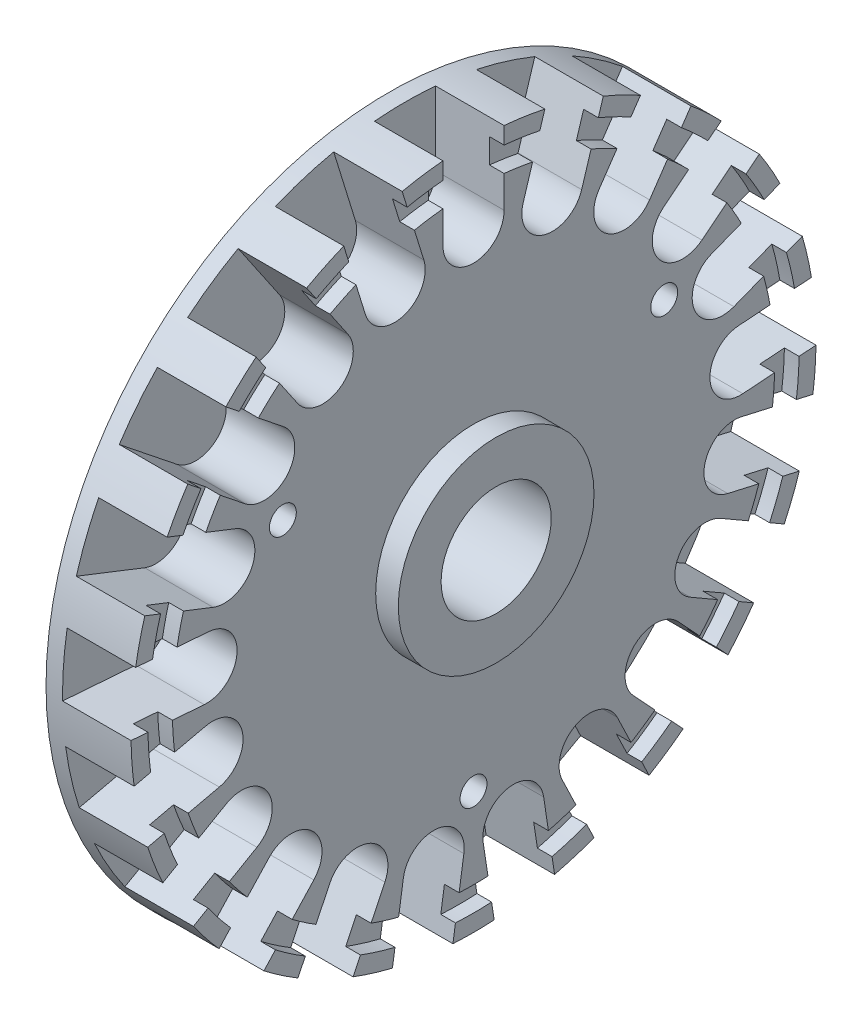
from build123d import *

# Parameters (mm, degrees)
CUT_EXTRUDE1_DEPTH      = 6.5
CIRPATTERN1_COUNT       = 21
BOSS_EXTRUDE1_START     = 1.85
SKETCH6_R               = 8
SKETCH6_R_2             = 4.5
BOSS_EXTRUDE1_DEPTH     = 1.85
M2_CLEARANCE_HOLE1_D    = 2.2
SKETCH10_R              = 28
CUT_EXTRUDE2_DEPTH      = 1.8
SKETCH11_R              = 28
BOSS_EXTRUDE2_DEPTH     = 0.9
SKETCH16_R              = 28
CUT_EXTRUDE4_DEPTH      = 1.25
CUT_EXTRUDE5_DEPTH      = 41.292710259
CUT_EXTRUDE5_DEPTH_BACK = 41.292710259
SKETCH21_R              = 4.5
SKETCH21_R_2            = 1.1


with BuildPart() as part:
    # Sketch2 → Revolve1 (revolve)
    with BuildSketch(Plane.XY, mode=Mode.PRIVATE) as revolve1_sk:
        Polygon((0, 4.5), (10, 4.5), (10, 24.62), (8.8, 24.62), (8.8, 26.62), (10, 26.62), (10, 28), (0, 28), align=None)
    revolve(revolve1_sk.sketch.rotate(Axis((-52.748606031, 0, 0), (1, 0, 0)), 90), axis=Axis((-52.748606031, 0, 0), (1, 0, 0)))

    # Sketch4 → Cut-Extrude1 (cut)
    with BuildSketch(Plane(origin=(10, 0, 0), x_dir=(0, 0, -1), z_dir=(1, 0, 0))):
        with BuildLine():
            Line((-2.499749016, 27.888192033), (-2.5, 21.888192038))
            ThreePointArc((-2.5, 21.888192038), (0, 19.388087459), (2.5, 21.888192038))
            Line((2.5, 21.888192038), (2.499749016, 27.888192033))
            ThreePointArc((2.499749016, 27.888192033), (0, 30.387836485), (-2.499749016, 27.888192033))
        make_face()
    cut_extrude1 = extrude(amount=-CUT_EXTRUDE1_DEPTH, mode=Mode.SUBTRACT)

    # CirPattern1: Cut-Extrude1 ×21 about axis
    cirpattern1_axis = Axis((0, 0, 0), (1, 0, 0))
    for i in range(1, CIRPATTERN1_COUNT):
        add(cut_extrude1.rotate(cirpattern1_axis, i * 360 / CIRPATTERN1_COUNT), mode=Mode.SUBTRACT)

    # Sketch6 → Boss-Extrude1 (add)
    with BuildSketch(Plane(origin=(10, 0, 0), x_dir=(0, 0, -1), z_dir=(1, 0, 0)).offset(BOSS_EXTRUDE1_START)):
        with Locations(Location((0, 0, 0), (0, 0, 180))):
            Circle(SKETCH6_R)
        with Locations(Location((0, 0, 0), (0, 0, 180))):
            Circle(SKETCH6_R_2, mode=Mode.SUBTRACT)
    extrude(amount=-BOSS_EXTRUDE1_DEPTH)

    # M2 Clearance Hole1 (through all)
    with Locations(Plane.ZY):
        with Locations((0, 0), (-1e-09, -18), (-15.588457268, 9.000000001), (15.588457268, 8.999999999)):
            Hole(M2_CLEARANCE_HOLE1_D / 2)

    # Sketch10 → Cut-Extrude2 (cut)
    with BuildSketch(Plane.ZY):
        Circle(SKETCH10_R)
    extrude(amount=-CUT_EXTRUDE2_DEPTH, mode=Mode.SUBTRACT)

    # Sketch11 → Boss-Extrude2 (add)
    with BuildSketch(Plane(origin=(3.5, 0, 0), x_dir=(0, 0, -1), z_dir=(1, 0, 0))):
        with Locations(Location((0, 0, 0), (0, 0, 180))):
            Circle(SKETCH11_R)
    extrude(amount=BOSS_EXTRUDE2_DEPTH)

    # Sketch16 → Cut-Extrude4 (cut)
    with BuildSketch(Plane.ZY.offset(-1.8)):
        Circle(SKETCH16_R)
    extrude(amount=-CUT_EXTRUDE4_DEPTH, mode=Mode.SUBTRACT)

    # Sketch21 → Cut-Extrude5 (cut, two sides: drawn at the far end of the back side and taken through both)
    with BuildSketch(Plane(origin=(4.4, 0, 0), x_dir=(0, 0, -1), z_dir=(1, 0, 0)).offset(-CUT_EXTRUDE5_DEPTH_BACK)):
        with Locations(Location((0, 0, 0), (0, 0, 180))):
            Circle(SKETCH21_R)
        with Locations(Location((1e-09, -18, 0), (0, 0, 180))):
            Circle(SKETCH21_R_2)
        with Locations(Location((-15.588457268, 8.999999999, 0), (0, 0, 180))):
            Circle(SKETCH21_R_2)
        with Locations(Location((15.588457268, 9.000000001, 0), (0, 0, 180))):
            Circle(SKETCH21_R_2)
    extrude(amount=CUT_EXTRUDE5_DEPTH + CUT_EXTRUDE5_DEPTH_BACK, mode=Mode.SUBTRACT)


solid = part.part
